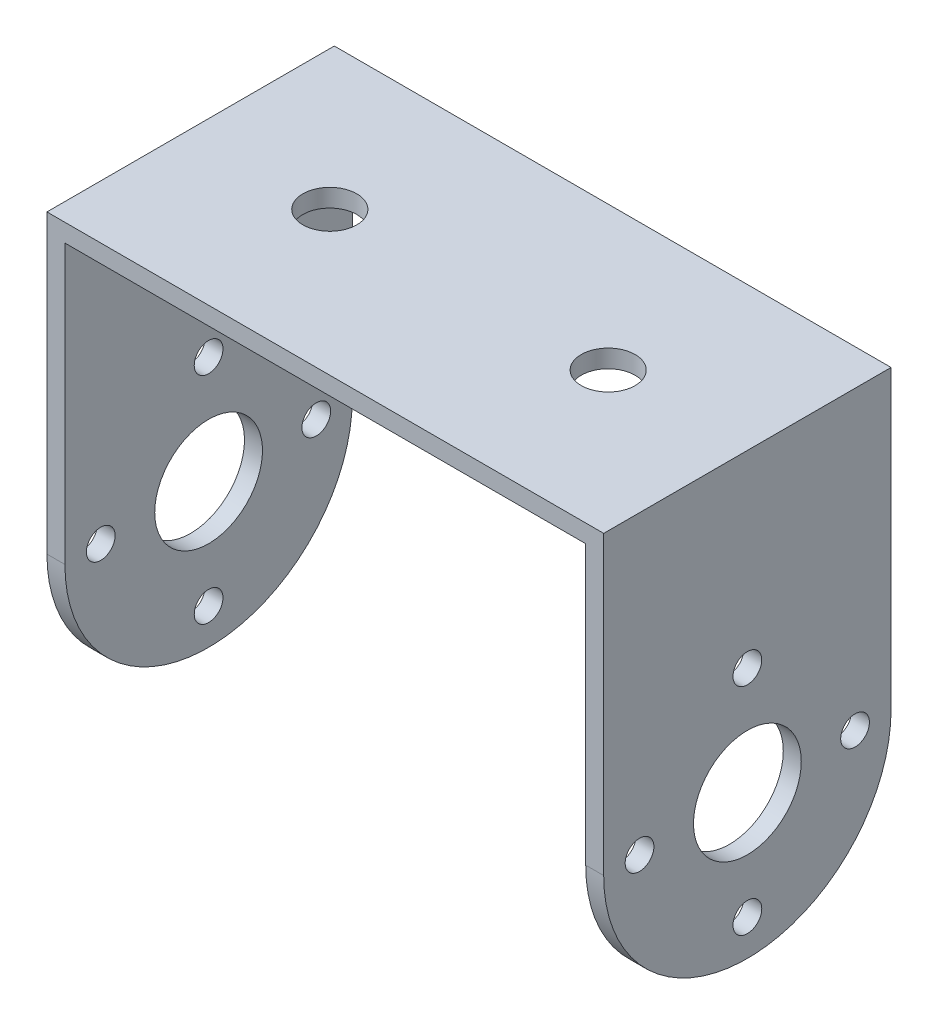
from build123d import *

# Parameters (mm, degrees)
SKETCH1_R           = 0.8
SKETCH1_R_2         = 3
BOSS_EXTRUDE1_DEPTH = 31
BOSS_EXTRUDE2_DEPTH = 1
SKETCH5_R           = 0.8
CUT_EXTRUDE3_DEPTH  = 1
SKETCH5_3_R         = 3
CUT_EXTRUDE4_DEPTH  = 1
CUT_EXTRUDE6_START  = -1
SKETCH6_W           = 28.997664588
SKETCH6_H           = 18.792631537
CUT_EXTRUDE6_DEPTH  = 104.494601352
SKETCH7_W           = 31
SKETCH7_H           = 56.017020421
CUT_EXTRUDE7_DEPTH  = 105.264671446
SKETCH8_R           = 1.5
CUT_EXTRUDE8_DEPTH  = 59.37205382


with BuildPart() as part:
    # Sketch1 → Boss-Extrude1 (new body)
    with BuildSketch(Plane(origin=(0, 0, 0), x_dir=(0, 0, -1), z_dir=(1, 0, 0))):
        with BuildLine():
            Line((27.520646447, 38.775594), (27.520646447, 55.275594))
            Line((27.520646447, 55.275594), (43.520646447, 55.275594))
            Line((43.520646447, 55.275594), (43.520646447, 38.775594))
            ThreePointArc((43.520646447, 38.775594), (35.520646447, 30.775594), (27.520646447, 38.775594))
        make_face()
        with Locations((35.520646447, 44.775594)):
            Circle(SKETCH1_R, mode=Mode.SUBTRACT)
        with Locations((41.515881392, 38.775594)):
            Circle(SKETCH1_R, mode=Mode.SUBTRACT)
        with Locations((35.520646447, 32.775594)):
            Circle(SKETCH1_R, mode=Mode.SUBTRACT)
        with Locations((29.515881392, 38.775594)):
            Circle(SKETCH1_R, mode=Mode.SUBTRACT)
        with Locations((35.520646447, 38.775594)):
            Circle(SKETCH1_R_2, mode=Mode.SUBTRACT)
    extrude(amount=BOSS_EXTRUDE1_DEPTH)

    # Sketch4 → Boss-Extrude2 (add)
    with BuildSketch(Plane(origin=(0, 55.275594, 0), x_dir=(1, 0, 0), z_dir=(0, 1, 0))):
        with BuildLine():
            Line((0, 43.520646447), (31, 43.520646447))
            Line((31, 43.520646447), (31, 65.088337856))
            Line((31, 65.088337856), (31, 81.236093118))
            ThreePointArc((31, 81.236093118), (15.5, 96.736093118), (0, 81.236093118))
            Line((0, 81.236093118), (0, 65.088337856))
            Line((0, 65.088337856), (0, 43.520646447))
        make_face()
    extrude(amount=-BOSS_EXTRUDE2_DEPTH)

    # Sketch5 → Cut-Extrude3 (cut)
    with BuildSketch(Plane.XZ.offset(-54.275594)):
        with Locations((9.5, -81.236093118)):
            Circle(SKETCH5_R)
        with Locations((15.5, -75.236093118)):
            Circle(SKETCH5_R)
        with Locations((21.5, -81.236093118)):
            Circle(SKETCH5_R)
        with Locations((15.5, -87.236093118)):
            Circle(SKETCH5_R)
    extrude(amount=-CUT_EXTRUDE3_DEPTH, mode=Mode.SUBTRACT)

    # Sketch5<3> → Cut-Extrude4 (cut)
    with BuildSketch(Plane.XZ.offset(-54.275594)):
        with Locations((15.5, -81.236093118)):
            Circle(SKETCH5_3_R)
    extrude(amount=-CUT_EXTRUDE4_DEPTH, mode=Mode.SUBTRACT)

    # Sketch6 → Cut-Extrude6 (cut, through all)
    with BuildSketch(Plane(origin=(0, 55.275594, 0), x_dir=(1, 0, 0), z_dir=(0, 1, 0)).offset(CUT_EXTRUDE6_START)):
        with Locations((15.5, 35.520646447)):
            Rectangle(SKETCH6_W, SKETCH6_H)
    extrude(amount=-CUT_EXTRUDE6_DEPTH, mode=Mode.SUBTRACT)

    # Sketch7 → Cut-Extrude7 (cut, through all)
    with BuildSketch(Plane.XZ.offset(-54.275594)):
        with Locations((15.5, -71.529156658)):
            Rectangle(SKETCH7_W, SKETCH7_H)
    extrude(amount=-CUT_EXTRUDE7_DEPTH, mode=Mode.SUBTRACT)

    # Sketch8 → Cut-Extrude8 (cut, through all)
    with BuildSketch(Plane.XZ.offset(-54.275594)):
        with Locations((7.75, -35.520646447)):
            Circle(SKETCH8_R)
        with Locations((23.25, -35.520646447)):
            Circle(SKETCH8_R)
    extrude(amount=-CUT_EXTRUDE8_DEPTH, mode=Mode.SUBTRACT)


solid = part.part
